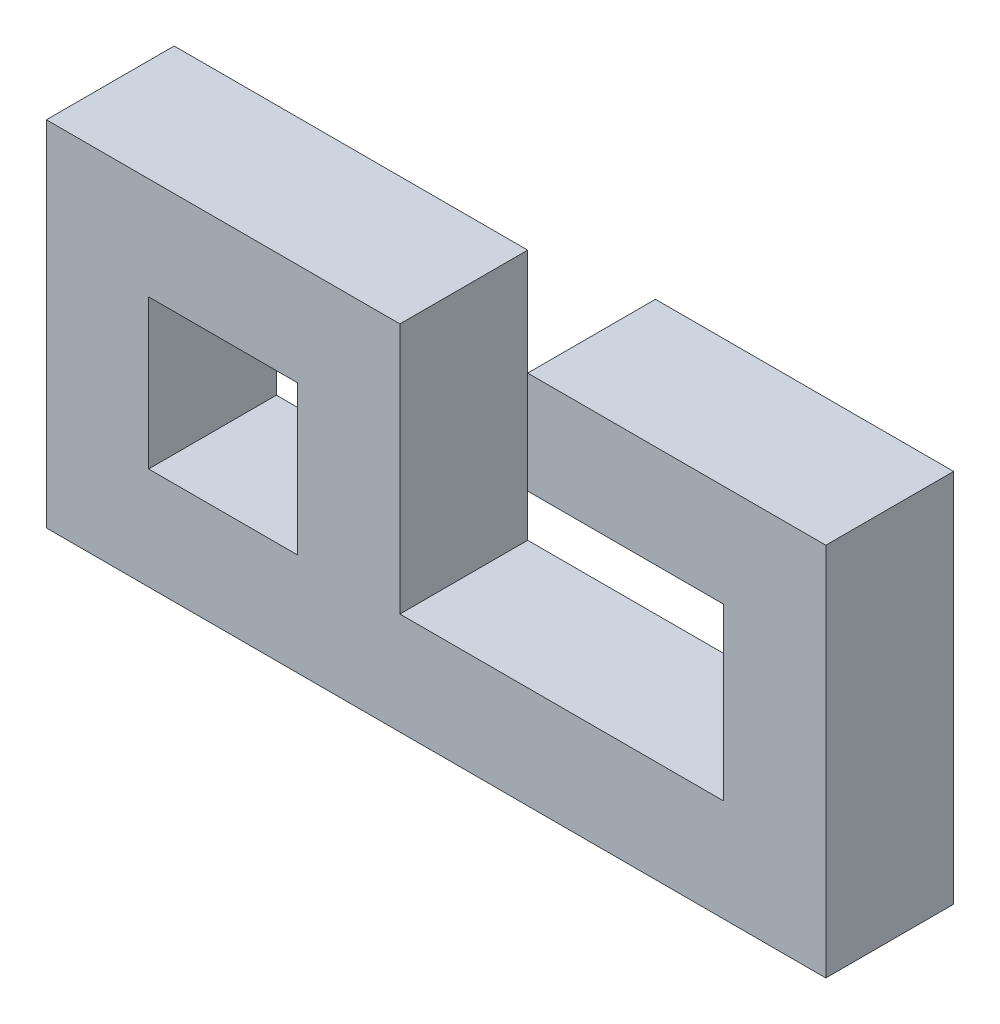
from build123d import *

# Parameters (mm, degrees)
CROQUIS1_W              = 3.5
CROQUIS1_H              = 3.5
SALIENTE_EXTRUIR1_DEPTH = 3


with BuildPart() as part:
    # Croquis1 → Saliente-Extruir1 (new body)
    with BuildSketch(Plane.XY):
        Polygon((-1.858993224, 4.484148454), (-1.858993224, -1.415851546), (5.741006776, -1.415851546), (5.741006776, 2.584148454), (1.141006776, 2.584148454), (1.141006776, 4.984148454), (8.141006776, 4.984148454), (8.141006776, -3.815851546), (-10.158993224, -3.815851546), (-10.158993224, 4.484148454), align=None)
        with Locations((-6.008993224, 0.334148454)):
            Rectangle(CROQUIS1_W, CROQUIS1_H, mode=Mode.SUBTRACT)
    extrude(amount=SALIENTE_EXTRUIR1_DEPTH)


solid = part.part
